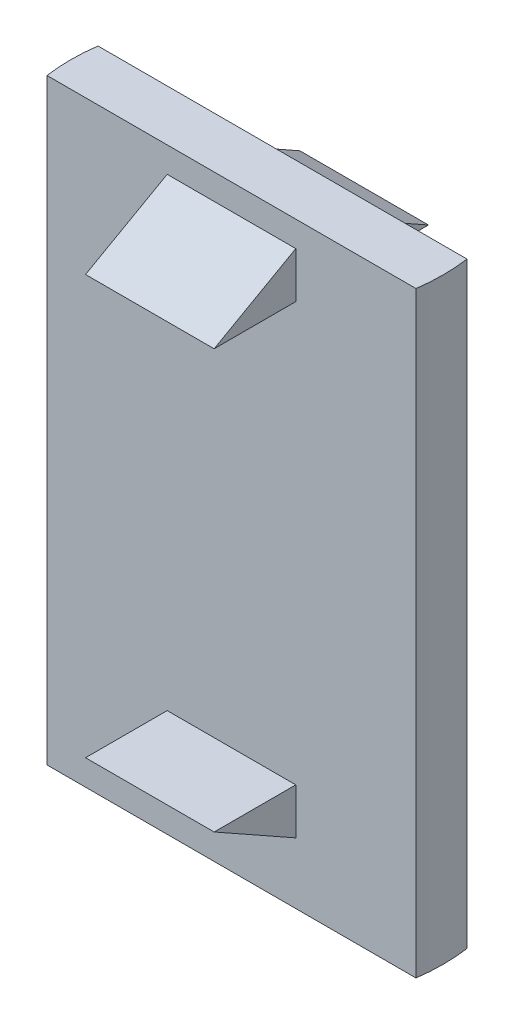
from build123d import *

# Parameters (mm, degrees)
SKETCH1_W           = 99.06
SKETCH1_H           = 360.68
BOSS_EXTRUDE1_DEPTH = 12.7
SKETCH3_W           = 32.004
SKETCH3_H           = 11.43
BOSS_EXTRUDE3_DEPTH = 20.32
SKETCH2_W           = 55.88
SKETCH2_H           = 12.7
BOSS_EXTRUDE4_DEPTH = 7.62
CUT_EXTRUDE2_DEPTH  = 38.1
SKETCH6_W           = 50.8
SKETCH6_H           = 5.08
CUT_EXTRUDE3_DEPTH  = 2.54
SKETCH7_R           = 50.8
SKETCH7_R_2         = 46.355
CUT_EXTRUDE4_DEPTH  = 366.559302576
SKETCH9_W           = 155.282238602
SKETCH9_H           = 226.847096393
CUT_EXTRUDE9_DEPTH  = 25.4


with BuildPart() as part:
    # Sketch1 → Boss-Extrude1 (new body)
    with BuildSketch(Plane.XY):
        Rectangle(SKETCH1_W, SKETCH1_H)
    extrude(amount=BOSS_EXTRUDE1_DEPTH)

    # Sketch3 → Boss-Extrude3 (add)
    with BuildSketch(Plane(origin=(0, 0, 0), x_dir=(-1, 0, 0), z_dir=(0, 0, -1))):
        with Locations((0, -43.815)):
            Rectangle(SKETCH3_W, SKETCH3_H)
        with Locations((0, -159.385)):
            Rectangle(SKETCH3_W, SKETCH3_H)
    boss_extrude3 = extrude(amount=BOSS_EXTRUDE3_DEPTH)

    # Sketch2 → Boss-Extrude4 (add, symmetric)
    with BuildSketch(Plane.XY.offset(12.7)):
        with Locations((0, 171.45)):
            Rectangle(SKETCH2_W, SKETCH2_H)
        with Locations((0, -19.05)):
            Rectangle(SKETCH2_W, SKETCH2_H)
    extrude(amount=BOSS_EXTRUDE4_DEPTH, both=True)

    # Mirror1: Boss-Extrude3 across plane
    add(boss_extrude3.mirror(Plane.XY.offset(6.35)))

    # Sketch5 → Cut-Extrude2 (cut, symmetric)
    with BuildSketch(Plane(origin=(0, 0, 0), x_dir=(0, 0, -1), z_dir=(1, 0, 0))):
        Polygon((20.32, -153.67), (0, -165.1), (20.32, -165.1), align=None)
        Polygon((-33.02, -153.67), (-12.7, -165.1), (-33.02, -165.1), align=None)
        Polygon((-33.02, -49.53), (-33.02, -38.1), (-12.7, -38.1), align=None)
        Polygon((20.32, -49.53), (0, -38.1), (20.32, -38.1), align=None)
        Polygon((-12.7, 177.8), (-20.32, 165.1), (-20.32, 177.8), align=None)
        Polygon((-20.32, -12.7), (-12.7, -25.4), (-20.32, -25.4), align=None)
    extrude(amount=CUT_EXTRUDE2_DEPTH, both=True, mode=Mode.SUBTRACT)

    # Sketch6 → Cut-Extrude3 (cut)
    with BuildSketch(Plane(origin=(0, 180.34, 0), x_dir=(1, 0, 0), z_dir=(0, 1, 0))):
        with Locations((0, -6.35)):
            Rectangle(SKETCH6_W, SKETCH6_H)
    cut_extrude3 = extrude(amount=-CUT_EXTRUDE3_DEPTH, mode=Mode.SUBTRACT)

    # Mirror2: Cut-Extrude3 across plane
    add(cut_extrude3.mirror(Plane.ZX), mode=Mode.SUBTRACT)

    # Sketch7 → Cut-Extrude4 (cut, through all)
    with BuildSketch(Plane(origin=(0, 180.34, 0), x_dir=(1, 0, 0), z_dir=(0, 1, 0))):
        with Locations((0, -6.35)):
            Circle(SKETCH7_R)
        with Locations((0, -6.35)):
            Circle(SKETCH7_R_2, mode=Mode.SUBTRACT)
    extrude(amount=-CUT_EXTRUDE4_DEPTH, mode=Mode.SUBTRACT)

    # Sketch9 → Cut-Extrude9 (cut, symmetric)
    with BuildSketch(Plane.XY):
        with Locations((0, 81.673548197)):
            Rectangle(SKETCH9_W, SKETCH9_H)
    extrude(amount=CUT_EXTRUDE9_DEPTH, both=True, mode=Mode.SUBTRACT)


solid = part.part
